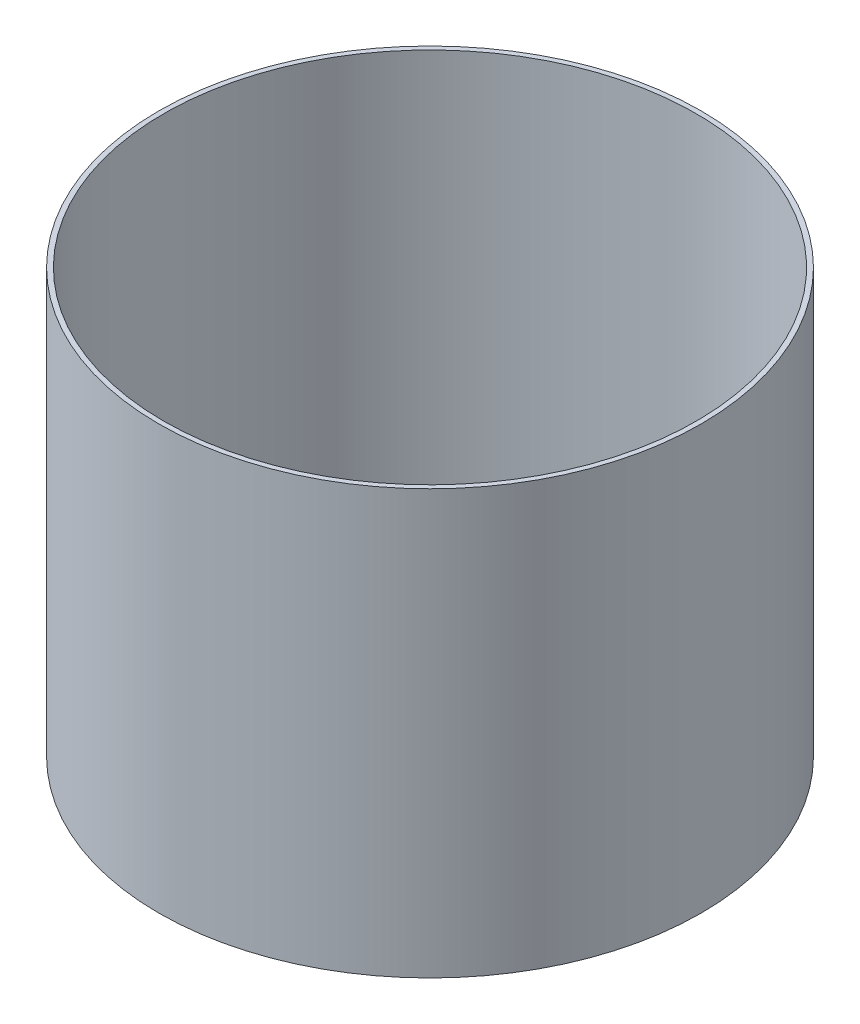
from build123d import *

# Parameters (mm, degrees)
SKETCH2_R      = 71.12
SKETCH2_R_2    = 69.85
EXTRUDE1_DEPTH = 111.125


with BuildPart() as part:
    # Sketch2 → Extrude1 (new body)
    with BuildSketch(Plane(origin=(0, 0, 0), x_dir=(1, 0, 0), z_dir=(0, 1, 0))):
        with Locations(Location((0, 0, 0), (0, 0, 270))):
            Circle(SKETCH2_R)
        with Locations(Location((0, 0, 0), (0, 0, 270))):
            Circle(SKETCH2_R_2, mode=Mode.SUBTRACT)
    extrude(amount=-EXTRUDE1_DEPTH)


solid = part.part
